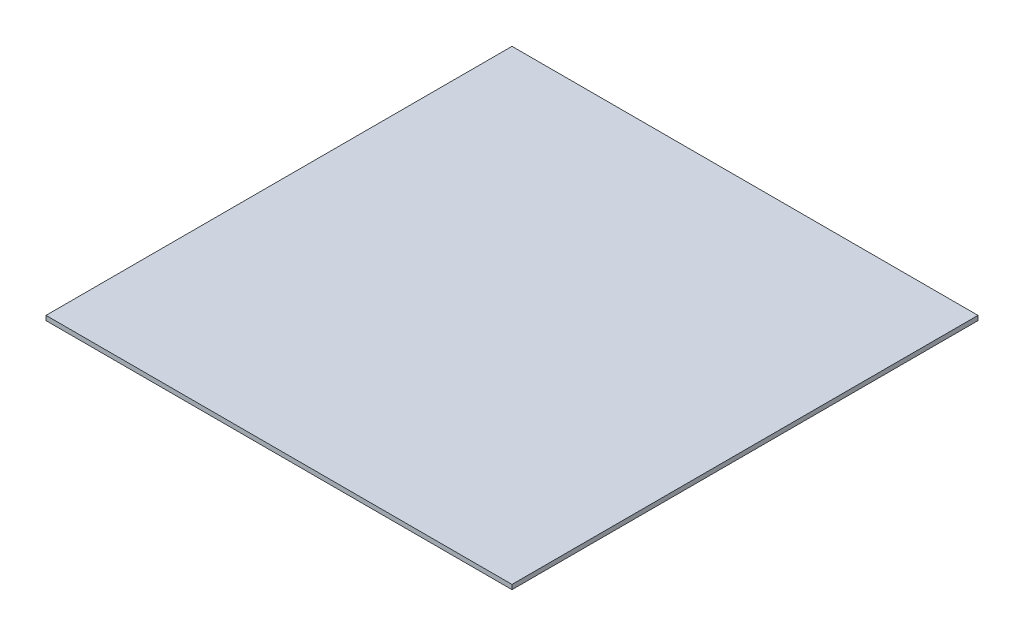
from build123d import *

# Parameters (mm, degrees)
SKETCH1_W           = 304.8
SKETCH1_H           = 304.8
BOSS_EXTRUDE1_DEPTH = 2.9972


with BuildPart() as part:
    # Sketch1 → Boss-Extrude1 (new body)
    with BuildSketch(Plane(origin=(0, 0, 0), x_dir=(1, 0, 0), z_dir=(0, 1, 0))):
        Rectangle(SKETCH1_W, SKETCH1_H)
    extrude(amount=BOSS_EXTRUDE1_DEPTH)


solid = part.part
